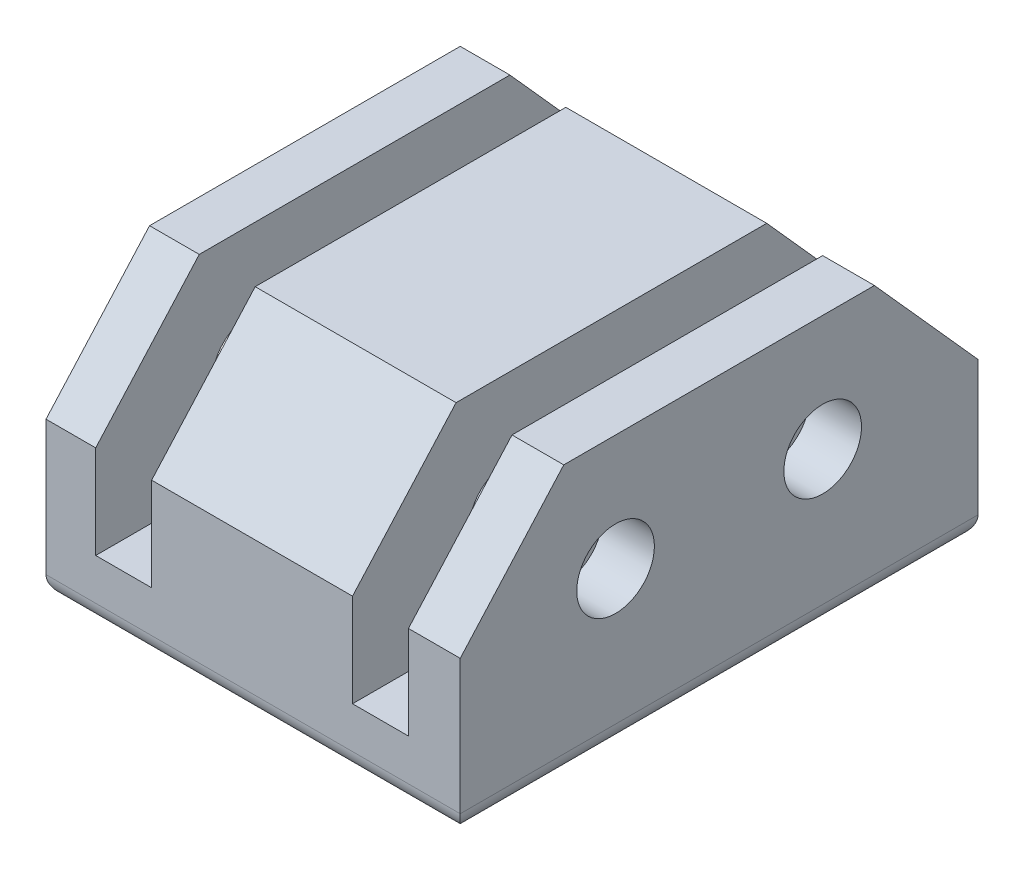
from build123d import *

# Parameters (mm, degrees)
SKETCH1_W           = 63.5
SKETCH1_H           = 6.35
BOSS_EXTRUDE1_DEPTH = 50.8
BOSS_EXTRUDE2_DEPTH = 50.8
SKETCH10_W          = 6.858
SKETCH10_H          = 25.629031657
CUT_EXTRUDE1_DEPTH  = 88.854357354
LPATTERN3_COUNT     = 2
LPATTERN3_PITCH     = 31.496
SKETCH11_R          = 4.7625
CUT_EXTRUDE2_DEPTH  = 88.854357354
FILLET1_R           = 2.54
SKETCH19_R          = 1.778
CUT_EXTRUDE3_DEPTH  = 7.62


with BuildPart() as part:
    # Sketch1 → Boss-Extrude1 (new body)
    with BuildSketch(Plane(origin=(0, 0, 0), x_dir=(0, 0, -1), z_dir=(1, 0, 0))):
        with Locations((31.75, 3.175)):
            Rectangle(SKETCH1_W, SKETCH1_H)
    extrude(amount=-BOSS_EXTRUDE1_DEPTH)

    # Sketch2 → Boss-Extrude2 (add)
    with BuildSketch(Plane(origin=(0, 0, 0), x_dir=(0, 0, -1), z_dir=(1, 0, 0))):
        Polygon((0, 6.35), (0, 19.05), (12.7, 33.249031657), (50.8, 33.249031657), (63.5, 19.05), (63.5, 6.35), align=None)
    extrude(amount=-BOSS_EXTRUDE2_DEPTH)

    # Sketch10 → Cut-Extrude1 (cut, through all)
    with BuildSketch(Plane(origin=(0, 0, -63.5), x_dir=(-1, 0, 0), z_dir=(0, 0, -1))):
        with Locations((9.779, 20.434515829)):
            Rectangle(SKETCH10_W, SKETCH10_H)
    cut_extrude1 = extrude(amount=-CUT_EXTRUDE1_DEPTH, mode=Mode.SUBTRACT)

    # LPattern3: Cut-Extrude1 ×2
    with Locations(*[(-i * LPATTERN3_PITCH, 0, 0) for i in range(1, LPATTERN3_COUNT)]):
        add(cut_extrude1, mode=Mode.SUBTRACT)

    # Sketch11 → Cut-Extrude2 (cut, through all)
    with BuildSketch(Plane(origin=(0, 0, 0), x_dir=(0, 0, -1), z_dir=(1, 0, 0))):
        with Locations((19.05, 19.05)):
            Circle(SKETCH11_R)
        with Locations((44.45, 19.05)):
            Circle(SKETCH11_R)
    extrude(amount=-CUT_EXTRUDE2_DEPTH, mode=Mode.SUBTRACT)

    # Fillet1
    fillet1_edges = [part.edges().sort_by_distance(p)[0] for p in [
        (0, 0, -31.75),
        (-50.8, 0, -31.75),
        (-25.4, 0, -63.5),
        (-25.4, 0, 0),
    ]]
    fillet(fillet1_edges, radius=FILLET1_R)

    # Sketch19 → Cut-Extrude3 (cut)
    with BuildSketch(Plane.XZ):
        with Locations(Location((-9.525, -50.8, 0), (0, 0, 270))):
            Circle(SKETCH19_R)
        with Locations(Location((-41.275, -50.8, 0), (0, 0, 270))):
            Circle(SKETCH19_R)
        with Locations(Location((-41.275, -12.7, 0), (0, 0, 270))):
            Circle(SKETCH19_R)
        with Locations(Location((-9.525, -12.7, 0), (0, 0, 270))):
            Circle(SKETCH19_R)
    extrude(amount=-CUT_EXTRUDE3_DEPTH, mode=Mode.SUBTRACT)


solid = part.part
